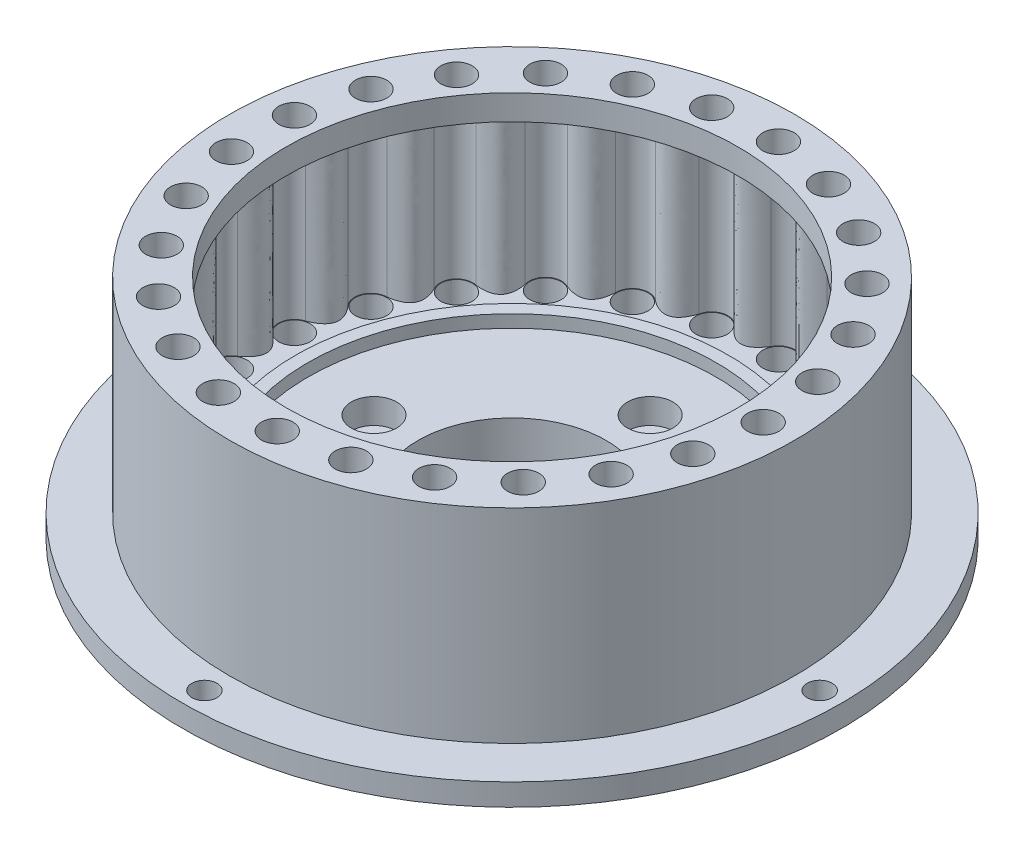
from build123d import *

# Parameters (mm, degrees)
SKETCH1_R           = 45
SKETCH1_R_2         = 2
BOSS_EXTRUDE1_DEPTH = 6
SKETCH2_R           = 3.61
CUT_EXTRUDE1_DEPTH  = 4
SKETCH4_R           = 15
CUT_EXTRUDE2_DEPTH  = 64.921827258
SKETCH5_R           = 2.5
CUT_EXTRUDE3_DEPTH  = 4
SKETCH6_R           = 34.5
SKETCH6_R_2         = 32.5
BOSS_EXTRUDE2_DEPTH = 2
SKETCH7_R           = 45
BOSS_EXTRUDE4_DEPTH = 30
BOSS_EXTRUDE5_START = -4
SKETCH8_R           = 45
SKETCH8_R_2         = 36
BOSS_EXTRUDE5_DEPTH = 4
SKETCH9_R           = 2.5
CUT_EXTRUDE4_DEPTH  = 4
SKETCH11_R          = 52.5
SKETCH11_R_2        = 45
BOSS_EXTRUDE7_DEPTH = 3.5
SKETCH12_R          = 2
CUT_EXTRUDE5_DEPTH  = 5


with BuildPart() as part:
    # Sketch1 → Boss-Extrude1 (new body)
    with BuildSketch(Plane(origin=(0, 0, 0), x_dir=(1, 0, 0), z_dir=(0, 1, 0))):
        with Locations(Location((0, 0, 0), (0, 0, 270))):
            Circle(SKETCH1_R)
        with Locations(Location((0, -22, 0), (0, 0, 270))):
            Circle(SKETCH1_R_2, mode=Mode.SUBTRACT)
        with Locations(Location((-22, 0, 0), (0, 0, 270))):
            Circle(SKETCH1_R_2, mode=Mode.SUBTRACT)
        with Locations(Location((0, 22, 0), (0, 0, 270))):
            Circle(SKETCH1_R_2, mode=Mode.SUBTRACT)
        with Locations(Location((22, 0, 0), (0, 0, 270))):
            Circle(SKETCH1_R_2, mode=Mode.SUBTRACT)
    extrude(amount=BOSS_EXTRUDE1_DEPTH)

    # Sketch2 → Cut-Extrude1 (cut)
    with BuildSketch(Plane(origin=(0, 6, 0), x_dir=(1, 0, 0), z_dir=(0, 1, 0))):
        with Locations(Location((0, 22, 0), (0, 0, 270))):
            Circle(SKETCH2_R)
        with Locations(Location((22, 0, 0), (0, 0, 270))):
            Circle(SKETCH2_R)
        with Locations(Location((0, -22, 0), (0, 0, 270))):
            Circle(SKETCH2_R)
        with Locations(Location((-22, 0, 0), (0, 0, 270))):
            Circle(SKETCH2_R)
    extrude(amount=-CUT_EXTRUDE1_DEPTH, mode=Mode.SUBTRACT)

    # Sketch4 → Cut-Extrude2 (cut, through all)
    with BuildSketch(Plane(origin=(0, 6, 0), x_dir=(1, 0, 0), z_dir=(0, 1, 0))):
        with Locations(Location((0, 0, 0), (0, 0, 270))):
            Circle(SKETCH4_R)
    extrude(amount=-CUT_EXTRUDE2_DEPTH, mode=Mode.SUBTRACT)

    # Sketch5 → Cut-Extrude3 (cut)
    with BuildSketch(Plane(origin=(0, 6, 0), x_dir=(1, 0, 0), z_dir=(0, 1, 0))):
        with Locations(Location((40, 0, 0), (0, 0, 270))):
            Circle(SKETCH5_R)
        with Locations(Location((38.743326445, -9.947595487, 0), (0, 0, 270))):
            Circle(SKETCH5_R)
        with Locations(Location((35.052267202, -19.270146964, 0), (0, 0, 270))):
            Circle(SKETCH5_R)
        with Locations(Location((29.158745097, -27.381884237, 0), (0, 0, 270))):
            Circle(SKETCH5_R)
        with Locations(Location((21.433071799, -33.77311702, 0), (0, 0, 270))):
            Circle(SKETCH5_R)
        with Locations(Location((12.360679775, -38.042260652, 0), (0, 0, 270))):
            Circle(SKETCH5_R)
        with Locations(Location((2.511620781, -39.921069137, 0), (0, 0, 270))):
            Circle(SKETCH5_R)
        with Locations(Location((-7.495252583, -39.291490029, 0), (0, 0, 270))):
            Circle(SKETCH5_R)
        with Locations(Location((-17.031171663, -36.193082099, 0), (0, 0, 270))):
            Circle(SKETCH5_R)
        with Locations(Location((-25.49695959, -30.820529711, 0), (0, 0, 270))):
            Circle(SKETCH5_R)
        with Locations(Location((-32.360679775, -23.511410092, 0), (0, 0, 270))):
            Circle(SKETCH5_R)
        with Locations(Location((-37.191059436, -14.724982107, 0), (0, 0, 270))):
            Circle(SKETCH5_R)
        with Locations(Location((-39.684588053, -5.013329343, 0), (0, 0, 270))):
            Circle(SKETCH5_R)
        with Locations(Location((-39.684588053, 5.013329343, 0), (0, 0, 270))):
            Circle(SKETCH5_R)
        with Locations(Location((-37.191059436, 14.724982107, 0), (0, 0, 270))):
            Circle(SKETCH5_R)
        with Locations(Location((-32.360679775, 23.511410092, 0), (0, 0, 270))):
            Circle(SKETCH5_R)
        with Locations(Location((-25.49695959, 30.820529711, 0), (0, 0, 270))):
            Circle(SKETCH5_R)
        with Locations(Location((-17.031171663, 36.193082099, 0), (0, 0, 270))):
            Circle(SKETCH5_R)
        with Locations(Location((-7.495252583, 39.291490029, 0), (0, 0, 270))):
            Circle(SKETCH5_R)
        with Locations(Location((2.511620781, 39.921069137, 0), (0, 0, 270))):
            Circle(SKETCH5_R)
        with Locations(Location((12.360679775, 38.042260652, 0), (0, 0, 270))):
            Circle(SKETCH5_R)
        with Locations(Location((21.433071799, 33.77311702, 0), (0, 0, 270))):
            Circle(SKETCH5_R)
        with Locations(Location((29.158745097, 27.381884237, 0), (0, 0, 270))):
            Circle(SKETCH5_R)
        with Locations(Location((35.052267202, 19.270146964, 0), (0, 0, 270))):
            Circle(SKETCH5_R)
        with Locations(Location((38.743326445, 9.947595487, 0), (0, 0, 270))):
            Circle(SKETCH5_R)
    extrude(amount=-CUT_EXTRUDE3_DEPTH, mode=Mode.SUBTRACT)

    # Sketch6 → Boss-Extrude2 (add)
    with BuildSketch(Plane(origin=(0, 6, 0), x_dir=(1, 0, 0), z_dir=(0, 1, 0))):
        with Locations(Location((0, 0, 0), (0, 0, 270))):
            Circle(SKETCH6_R)
        with Locations(Location((0, 0, 0), (0, 0, 270))):
            Circle(SKETCH6_R_2, mode=Mode.SUBTRACT)
    extrude(amount=BOSS_EXTRUDE2_DEPTH)

    # Sketch7 → Boss-Extrude4 (add)
    with BuildSketch(Plane(origin=(0, 6, 0), x_dir=(1, 0, 0), z_dir=(0, 1, 0))):
        with Locations(Location((0, 0, 0), (0, 0, 270))):
            Circle(SKETCH7_R)
        with BuildLine():
            ThreePointArc((34.786085666, -21.856485571), (37.33066457, -20.522706517), (37.093357913, -17.659572934))
            add(Edge.make_bspline(
                [(37.093357913, -17.659572934), (36.992833187, -17.498762481), (36.795597124, -17.160956609), (36.491730857, -16.541708189), (36.246669275, -15.818483644), (36.175890696, -15.051815417), (36.318726706, -14.379601147), (36.674766069, -13.791800055), (37.251181949, -13.281374242), (37.924905423, -12.921922435), (38.570319112, -12.678520537), (38.945342047, -12.567288031), (39.128703748, -12.518876166)],
                knots=[0.000576873, 0.000576873, 0.000576873, 0.000576873, 0.063004764, 0.125432655, 0.250288437, 0.375144218, 0.5, 0.624855782, 0.749711563, 0.874567345, 0.936995236, 0.999423127, 0.999423127, 0.999423127, 0.999423127], degree=3))
            ThreePointArc((39.128703748, -12.518876166), (41.261642664, -10.594189193), (40.319759065, -7.880021982))
            add(Edge.make_bspline(
                [(40.319759065, -7.880021982), (40.182400575, -7.749263168), (39.907352141, -7.471120704), (39.459031572, -6.946895579), (39.041810419, -6.3073368), (38.782592844, -5.582356783), (38.753768508, -4.895739488), (38.952442052, -4.237861859), (39.383811029, -3.600123211), (39.946976213, -3.084416029), (40.511581453, -2.688153193), (40.847159953, -2.487150849), (41.012721469, -2.394659731)],
                knots=[0.000576873, 0.000576873, 0.000576873, 0.000576873, 0.063004764, 0.125432655, 0.250288437, 0.375144218, 0.5, 0.624855782, 0.749711563, 0.874567345, 0.936995236, 0.999423127, 0.999423127, 0.999423127, 0.999423127], degree=3))
            ThreePointArc((41.012721469, -2.394659731), (42.6, 0), (41.012721469, 2.394659731))
            add(Edge.make_bspline(
                [(41.012721469, 2.394659731), (40.847159953, 2.487150849), (40.511581453, 2.688153193), (39.946976213, 3.084416029), (39.383811029, 3.600123211), (38.952442052, 4.237861859), (38.753768508, 4.895739488), (38.782592844, 5.582356783), (39.041810419, 6.3073368), (39.459031572, 6.946895579), (39.907352141, 7.471120704), (40.182400575, 7.749263168), (40.319759065, 7.880021982)],
                knots=[0.000576873, 0.000576873, 0.000576873, 0.000576873, 0.063004764, 0.125432655, 0.250288437, 0.375144218, 0.5, 0.624855782, 0.749711563, 0.874567345, 0.936995236, 0.999423127, 0.999423127, 0.999423127, 0.999423127], degree=3))
            ThreePointArc((40.319759065, 7.880021982), (41.261642664, 10.594189193), (39.128703748, 12.518876166))
            add(Edge.make_bspline(
                [(39.128703748, 12.518876166), (38.945342047, 12.567288031), (38.570319112, 12.678520537), (37.924905423, 12.921922435), (37.251181949, 13.281374242), (36.674766069, 13.791800055), (36.318726706, 14.379601147), (36.175890696, 15.051815417), (36.246669275, 15.818483644), (36.491730857, 16.541708189), (36.795597124, 17.160956609), (36.992833187, 17.498762481), (37.093357913, 17.659572934)],
                knots=[0.000576873, 0.000576873, 0.000576873, 0.000576873, 0.063004764, 0.125432655, 0.250288437, 0.375144218, 0.5, 0.624855782, 0.749711563, 0.874567345, 0.936995236, 0.999423127, 0.999423127, 0.999423127, 0.999423127], degree=3))
            ThreePointArc((37.093357913, 17.659572934), (37.33066457, 20.522706517), (34.786085666, 21.856485571))
            add(Edge.make_bspline(
                [(34.786085666, 21.856485571), (34.596445068, 21.857776287), (34.20554177, 21.872249808), (33.519873348, 21.94749693), (32.777924106, 22.128107683), (32.092679653, 22.479148731), (31.601645735, 22.959939581), (31.296124289, 23.575513133), (31.174016594, 24.335696984), (31.231520486, 25.097144438), (31.371839415, 25.772506497), (31.478870041, 26.148750191), (31.536244664, 26.32950797)],
                knots=[0.000576873, 0.000576873, 0.000576873, 0.000576873, 0.063004764, 0.125432655, 0.250288437, 0.375144218, 0.5, 0.624855782, 0.749711563, 0.874567345, 0.936995236, 0.999423127, 0.999423127, 0.999423127, 0.999423127], degree=3))
            ThreePointArc((31.536244664, 26.32950797), (31.054063528, 29.161706713), (28.257729887, 29.820771605))
            add(Edge.make_bspline(
                [(28.257729887, 29.820771605), (28.07372621, 29.774860072), (27.691504438, 29.691665184), (27.008664353, 29.594029476), (26.245108743, 29.584450736), (25.494092146, 29.754049819), (24.898917139, 30.097620571), (24.449907294, 30.617874654), (24.1425858, 31.323808983), (24.00891882, 32.0756348), (23.976873658, 32.764675018), (23.986973718, 33.155715758), (23.997593181, 33.345063188)],
                knots=[0.000576873, 0.000576873, 0.000576873, 0.000576873, 0.063004764, 0.125432655, 0.250288437, 0.375144218, 0.5, 0.624855782, 0.749711563, 0.874567345, 0.936995236, 0.999423127, 0.999423127, 0.999423127, 0.999423127], degree=3))
            ThreePointArc((23.997593181, 33.345063188), (22.826221466, 35.968369626), (19.953837015, 35.911308886))
            add(Edge.make_bspline(
                [(19.953837015, 35.911308886), (19.787031885, 35.821079894), (19.437508041, 35.645444037), (18.800401646, 35.381060311), (18.063216675, 35.181893946), (17.293617069, 35.159394529), (16.631698007, 35.344157369), (16.067412703, 35.736402505), (15.594187551, 36.343730862), (15.277748487, 37.038695063), (15.075352749, 37.698118507), (14.987887619, 38.079385766), (14.951084661, 38.265425451)],
                knots=[0.000576873, 0.000576873, 0.000576873, 0.000576873, 0.063004764, 0.125432655, 0.250288437, 0.375144218, 0.5, 0.624855782, 0.749711563, 0.874567345, 0.936995236, 0.999423127, 0.999423127, 0.999423127, 0.999423127], degree=3))
            ThreePointArc((14.951084661, 38.265425451), (13.16412396, 40.515007594), (10.396171178, 39.745406556))
            add(Edge.make_bspline(
                [(10.396171178, 39.745406556), (10.257045576, 39.616529525), (9.962181528, 39.359488547), (9.41084056, 38.944969004), (8.746346272, 38.56872937), (8.00652043, 38.355545174), (7.319448123, 38.369890772), (6.675343481, 38.609480758), (6.065949146, 39.080042468), (5.586621029, 39.674477895), (5.226591983, 40.262850566), (5.047057419, 40.61038792), (4.965144505, 40.781430303)],
                knots=[0.000576873, 0.000576873, 0.000576873, 0.000576873, 0.063004764, 0.125432655, 0.250288437, 0.375144218, 0.5, 0.624855782, 0.749711563, 0.874567345, 0.936995236, 0.999423127, 0.999423127, 0.999423127, 0.999423127], degree=3))
            ThreePointArc((4.965144505, 40.781430303), (2.674876132, 42.515938631), (0.185275671, 41.08215416))
            add(Edge.make_bspline(
                [(0.185275671, 41.08215416), (0.08257137, 40.922726908), (-0.13910549, 40.600431637), (-0.570038249, 40.061822065), (-1.120089235, 39.532149681), (-1.783655334, 39.141675854), (-2.452709606, 38.984702824), (-3.136162123, 39.056583339), (-3.843435152, 39.360811279), (-4.455534375, 39.817367369), (-4.95057478, 40.297719647), (-5.21089796, 40.589690046), (-5.33277394, 40.734987905)],
                knots=[0.000576873, 0.000576873, 0.000576873, 0.000576873, 0.063004764, 0.125432655, 0.250288437, 0.375144218, 0.5, 0.624855782, 0.749711563, 0.874567345, 0.936995236, 0.999423127, 0.999423127, 0.999423127, 0.999423127], degree=3))
            ThreePointArc((-5.33277394, 40.734987905), (-7.982444001, 41.845436881), (-10.037261387, 39.837558928))
            add(Edge.make_bspline(
                [(-10.037261387, 39.837558928), (-10.097091098, 39.657598855), (-10.231651998, 39.290300289), (-10.515099458, 38.661443509), (-10.916145416, 38.011619639), (-11.461757473, 37.468391087), (-12.07075457, 37.149962622), (-12.750611127, 37.049617149), (-13.511322285, 37.168395559), (-14.217732168, 37.458385213), (-14.816678722, 37.800534799), (-15.141433456, 38.018592668), (-15.295614586, 38.129016404)],
                knots=[0.000576873, 0.000576873, 0.000576873, 0.000576873, 0.063004764, 0.125432655, 0.250288437, 0.375144218, 0.5, 0.624855782, 0.749711563, 0.874567345, 0.936995236, 0.999423127, 0.999423127, 0.999423127, 0.999423127], degree=3))
            ThreePointArc((-15.295614586, 38.129016404), (-18.138197821, 38.545632435), (-19.629120398, 36.089823356))
            add(Edge.make_bspline(
                [(-19.629120398, 36.089823356), (-19.642316199, 35.900638016), (-19.681306181, 35.511414875), (-19.799458296, 34.83182427), (-20.026300033, 34.102679738), (-20.419675237, 33.440829508), (-20.930349631, 32.98095364), (-21.56389234, 32.714687254), (-22.330243348, 32.64055285), (-23.086577559, 32.745754952), (-23.751796248, 32.928203329), (-24.120577002, 33.058647291), (-24.297375514, 33.127258574)],
                knots=[0.000576873, 0.000576873, 0.000576873, 0.000576873, 0.063004764, 0.125432655, 0.250288437, 0.375144218, 0.5, 0.624855782, 0.749711563, 0.874567345, 0.936995236, 0.999423127, 0.999423127, 0.999423127, 0.999423127], degree=3))
            ThreePointArc((-24.297375514, 33.127258574), (-27.154261963, 32.823864142), (-27.987609584, 30.074431454))
            add(Edge.make_bspline(
                [(-27.987609584, 30.074431454), (-27.953342333, 29.887908057), (-27.894311514, 29.501216663), (-27.839744353, 28.813593409), (-27.878128568, 28.050943048), (-28.094549707, 27.312057625), (-28.474813849, 26.739630046), (-29.022234891, 26.324173243), (-29.746073096, 26.061784162), (-30.504808376, 25.975588477), (-31.194501062, 25.986871742), (-31.584135985, 26.021505523), (-31.77244298, 26.043993254)],
                knots=[0.000576873, 0.000576873, 0.000576873, 0.000576873, 0.063004764, 0.125432655, 0.250288437, 0.375144218, 0.5, 0.624855782, 0.749711563, 0.874567345, 0.936995236, 0.999423127, 0.999423127, 0.999423127, 0.999423127], degree=3))
            ThreePointArc((-31.77244298, 26.043993254), (-34.46412396, 25.039651748), (-34.587534328, 22.169352418))
            add(Edge.make_bspline(
                [(-34.587534328, 22.169352418), (-34.507957163, 21.997210914), (-34.354614667, 21.637348509), (-34.130756884, 20.984898506), (-33.978271756, 20.236662442), (-34.004140295, 19.467168715), (-34.230100789, 18.818157154), (-34.657003687, 18.279614614), (-35.292847673, 17.845457726), (-36.006309894, 17.573280246), (-36.67714065, 17.41268943), (-37.063147546, 17.349336862), (-37.251131002, 17.324288055)],
                knots=[0.000576873, 0.000576873, 0.000576873, 0.000576873, 0.063004764, 0.125432655, 0.250288437, 0.375144218, 0.5, 0.624855782, 0.749711563, 0.874567345, 0.936995236, 0.999423127, 0.999423127, 0.999423127, 0.999423127], degree=3))
            ThreePointArc((-37.251131002, 17.324288055), (-39.608478299, 15.682105944), (-39.014197086, 12.871291436))
            add(Edge.make_bspline(
                [(-39.014197086, 12.871291436), (-38.894310133, 12.72434811), (-38.656291033, 12.413926172), (-38.277208436, 11.837645253), (-37.943435166, 11.15083791), (-37.77712569, 10.399085999), (-37.834584607, 9.71427024), (-38.114145482, 9.086480571), (-38.622042832, 8.507835551), (-39.245402539, 8.066778187), (-39.855220601, 7.744403802), (-40.213345238, 7.58704556), (-40.389193463, 7.516034123)],
                knots=[0.000576873, 0.000576873, 0.000576873, 0.000576873, 0.063004764, 0.125432655, 0.250288437, 0.375144218, 0.5, 0.624855782, 0.749711563, 0.874567345, 0.936995236, 0.999423127, 0.999423127, 0.999423127, 0.999423127], degree=3))
            ThreePointArc((-40.389193463, 7.516034123), (-42.264086276, 5.33919575), (-40.989454357, 2.764479875))
            add(Edge.make_bspline(
                [(-40.989454357, 2.764479875), (-40.836790555, 2.651967717), (-40.529050465, 2.410491199), (-40.018562208, 1.946589212), (-39.524472999, 1.364365222), (-39.176435343, 0.677590465), (-39.061782329, 0), (-39.176435343, -0.677590465), (-39.524472999, -1.364365222), (-40.018562208, -1.946589212), (-40.529050465, -2.410491199), (-40.836790555, -2.651967717), (-40.989454357, -2.764479875)],
                knots=[0.000576873, 0.000576873, 0.000576873, 0.000576873, 0.063004764, 0.125432655, 0.250288437, 0.375144218, 0.5, 0.624855782, 0.749711563, 0.874567345, 0.936995236, 0.999423127, 0.999423127, 0.999423127, 0.999423127], degree=3))
            ThreePointArc((-40.989454357, -2.764479875), (-42.264086276, -5.33919575), (-40.389193463, -7.516034123))
            add(Edge.make_bspline(
                [(-40.389193463, -7.516034123), (-40.213345238, -7.58704556), (-39.855220601, -7.744403802), (-39.245402539, -8.066778187), (-38.622042832, -8.507835551), (-38.114145482, -9.086480571), (-37.834584607, -9.71427024), (-37.77712569, -10.399085999), (-37.943435166, -11.15083791), (-38.277208436, -11.837645253), (-38.656291033, -12.413926172), (-38.894310133, -12.72434811), (-39.014197086, -12.871291436)],
                knots=[0.000576873, 0.000576873, 0.000576873, 0.000576873, 0.063004764, 0.125432655, 0.250288437, 0.375144218, 0.5, 0.624855782, 0.749711563, 0.874567345, 0.936995236, 0.999423127, 0.999423127, 0.999423127, 0.999423127], degree=3))
            ThreePointArc((-39.014197086, -12.871291436), (-39.608478299, -15.682105944), (-37.251131002, -17.324288055))
            add(Edge.make_bspline(
                [(-37.251131002, -17.324288055), (-37.063147546, -17.349336862), (-36.67714065, -17.41268943), (-36.006309894, -17.573280246), (-35.292847673, -17.845457726), (-34.657003687, -18.279614614), (-34.230100789, -18.818157154), (-34.004140295, -19.467168715), (-33.978271756, -20.236662442), (-34.130756884, -20.984898506), (-34.354614667, -21.637348509), (-34.507957163, -21.997210914), (-34.587534328, -22.169352418)],
                knots=[0.000576873, 0.000576873, 0.000576873, 0.000576873, 0.063004764, 0.125432655, 0.250288437, 0.375144218, 0.5, 0.624855782, 0.749711563, 0.874567345, 0.936995236, 0.999423127, 0.999423127, 0.999423127, 0.999423127], degree=3))
            ThreePointArc((-34.587534328, -22.169352418), (-34.46412396, -25.039651748), (-31.77244298, -26.043993254))
            add(Edge.make_bspline(
                [(-31.77244298, -26.043993254), (-31.584135985, -26.021505523), (-31.194501062, -25.986871742), (-30.504808376, -25.975588477), (-29.746073096, -26.061784162), (-29.022234891, -26.324173243), (-28.474813849, -26.739630046), (-28.094549707, -27.312057625), (-27.878128568, -28.050943048), (-27.839744353, -28.813593409), (-27.894311514, -29.501216663), (-27.953342333, -29.887908057), (-27.987609584, -30.074431454)],
                knots=[0.000576873, 0.000576873, 0.000576873, 0.000576873, 0.063004764, 0.125432655, 0.250288437, 0.375144218, 0.5, 0.624855782, 0.749711563, 0.874567345, 0.936995236, 0.999423127, 0.999423127, 0.999423127, 0.999423127], degree=3))
            ThreePointArc((-27.987609584, -30.074431454), (-27.154261963, -32.823864142), (-24.297375514, -33.127258574))
            add(Edge.make_bspline(
                [(-24.297375514, -33.127258574), (-24.120577002, -33.058647291), (-23.751796248, -32.928203329), (-23.086577559, -32.745754952), (-22.330243348, -32.64055285), (-21.56389234, -32.714687254), (-20.930349631, -32.98095364), (-20.419675237, -33.440829508), (-20.026300033, -34.102679738), (-19.799458296, -34.83182427), (-19.681306181, -35.511414875), (-19.642316199, -35.900638016), (-19.629120398, -36.089823356)],
                knots=[0.000576873, 0.000576873, 0.000576873, 0.000576873, 0.063004764, 0.125432655, 0.250288437, 0.375144218, 0.5, 0.624855782, 0.749711563, 0.874567345, 0.936995236, 0.999423127, 0.999423127, 0.999423127, 0.999423127], degree=3))
            ThreePointArc((-19.629120398, -36.089823356), (-18.138197821, -38.545632435), (-15.295614586, -38.129016404))
            add(Edge.make_bspline(
                [(-15.295614586, -38.129016404), (-15.141433456, -38.018592668), (-14.816678722, -37.800534799), (-14.217732168, -37.458385213), (-13.511322285, -37.168395559), (-12.750611127, -37.049617149), (-12.07075457, -37.149962622), (-11.461757473, -37.468391087), (-10.916145416, -38.011619639), (-10.515099458, -38.661443509), (-10.231651998, -39.290300289), (-10.097091098, -39.657598855), (-10.037261387, -39.837558928)],
                knots=[0.000576873, 0.000576873, 0.000576873, 0.000576873, 0.063004764, 0.125432655, 0.250288437, 0.375144218, 0.5, 0.624855782, 0.749711563, 0.874567345, 0.936995236, 0.999423127, 0.999423127, 0.999423127, 0.999423127], degree=3))
            ThreePointArc((-10.037261387, -39.837558928), (-7.982444001, -41.845436881), (-5.33277394, -40.734987905))
            add(Edge.make_bspline(
                [(-5.33277394, -40.734987905), (-5.21089796, -40.589690046), (-4.95057478, -40.297719647), (-4.455534375, -39.817367369), (-3.843435152, -39.360811279), (-3.136162123, -39.056583339), (-2.452709606, -38.984702824), (-1.783655334, -39.141675854), (-1.120089235, -39.532149681), (-0.570038249, -40.061822065), (-0.13910549, -40.600431637), (0.08257137, -40.922726908), (0.185275671, -41.08215416)],
                knots=[0.000576873, 0.000576873, 0.000576873, 0.000576873, 0.063004764, 0.125432655, 0.250288437, 0.375144218, 0.5, 0.624855782, 0.749711563, 0.874567345, 0.936995236, 0.999423127, 0.999423127, 0.999423127, 0.999423127], degree=3))
            ThreePointArc((0.185275671, -41.08215416), (2.674876132, -42.515938631), (4.965144505, -40.781430303))
            add(Edge.make_bspline(
                [(4.965144505, -40.781430303), (5.047057419, -40.61038792), (5.226591983, -40.262850566), (5.586621029, -39.674477895), (6.065949146, -39.080042468), (6.675343481, -38.609480758), (7.319448123, -38.369890772), (8.00652043, -38.355545174), (8.746346272, -38.56872937), (9.41084056, -38.944969004), (9.962181528, -39.359488547), (10.257045576, -39.616529525), (10.396171178, -39.745406556)],
                knots=[0.000576873, 0.000576873, 0.000576873, 0.000576873, 0.063004764, 0.125432655, 0.250288437, 0.375144218, 0.5, 0.624855782, 0.749711563, 0.874567345, 0.936995236, 0.999423127, 0.999423127, 0.999423127, 0.999423127], degree=3))
            ThreePointArc((10.396171178, -39.745406556), (13.16412396, -40.515007594), (14.951084661, -38.265425451))
            add(Edge.make_bspline(
                [(14.951084661, -38.265425451), (14.987887619, -38.079385766), (15.075352749, -37.698118507), (15.277748487, -37.038695063), (15.594187551, -36.343730862), (16.067412703, -35.736402505), (16.631698007, -35.344157369), (17.293617069, -35.159394529), (18.063216675, -35.181893946), (18.800401646, -35.381060311), (19.437508041, -35.645444037), (19.787031885, -35.821079894), (19.953837015, -35.911308886)],
                knots=[0.000576873, 0.000576873, 0.000576873, 0.000576873, 0.063004764, 0.125432655, 0.250288437, 0.375144218, 0.5, 0.624855782, 0.749711563, 0.874567345, 0.936995236, 0.999423127, 0.999423127, 0.999423127, 0.999423127], degree=3))
            ThreePointArc((19.953837015, -35.911308886), (22.826221466, -35.968369626), (23.997593181, -33.345063188))
            add(Edge.make_bspline(
                [(23.997593181, -33.345063188), (23.986973718, -33.155715758), (23.976873658, -32.764675018), (24.00891882, -32.0756348), (24.1425858, -31.323808983), (24.449907294, -30.617874654), (24.898917139, -30.097620571), (25.494092146, -29.754049819), (26.245108743, -29.584450736), (27.008664353, -29.594029476), (27.691504438, -29.691665184), (28.07372621, -29.774860072), (28.257729887, -29.820771605)],
                knots=[0.000576873, 0.000576873, 0.000576873, 0.000576873, 0.063004764, 0.125432655, 0.250288437, 0.375144218, 0.5, 0.624855782, 0.749711563, 0.874567345, 0.936995236, 0.999423127, 0.999423127, 0.999423127, 0.999423127], degree=3))
            ThreePointArc((28.257729887, -29.820771605), (31.054063528, -29.161706713), (31.536244664, -26.32950797))
            add(Edge.make_bspline(
                [(31.536244664, -26.32950797), (31.478870041, -26.148750191), (31.371839415, -25.772506497), (31.231520486, -25.097144438), (31.174016594, -24.335696984), (31.296124289, -23.575513133), (31.601645735, -22.959939581), (32.092679653, -22.479148731), (32.777924106, -22.128107683), (33.519873348, -21.94749693), (34.20554177, -21.872249808), (34.596445068, -21.857776287), (34.786085666, -21.856485571)],
                knots=[0.000576873, 0.000576873, 0.000576873, 0.000576873, 0.063004764, 0.125432655, 0.250288437, 0.375144218, 0.5, 0.624855782, 0.749711563, 0.874567345, 0.936995236, 0.999423127, 0.999423127, 0.999423127, 0.999423127], degree=3))
        make_face(mode=Mode.SUBTRACT)
    extrude(amount=BOSS_EXTRUDE4_DEPTH)

    # Sketch8 → Boss-Extrude5 (add)
    with BuildSketch(Plane(origin=(0, 36, 0), x_dir=(1, 0, 0), z_dir=(0, 1, 0)).offset(BOSS_EXTRUDE5_START)):
        with Locations(Location((0, 0, 0), (0, 0, 270))):
            Circle(SKETCH8_R)
        with Locations(Location((0, 0, 0), (0, 0, 270))):
            Circle(SKETCH8_R_2, mode=Mode.SUBTRACT)
    extrude(amount=BOSS_EXTRUDE5_DEPTH)

    # Sketch9 → Cut-Extrude4 (cut)
    with BuildSketch(Plane(origin=(0, 36, 0), x_dir=(1, 0, 0), z_dir=(0, 1, 0))):
        with Locations(Location((-17.031171663, 36.193082099, 0), (0, 0, 270))):
            Circle(SKETCH9_R)
        with Locations(Location((-7.495252583, 39.291490029, 0), (0, 0, 270))):
            Circle(SKETCH9_R)
        with Locations(Location((12.360679775, 38.042260652, 0), (0, 0, 270))):
            Circle(SKETCH9_R)
        with Locations(Location((21.433071799, 33.77311702, 0), (0, 0, 270))):
            Circle(SKETCH9_R)
        with Locations(Location((29.158745097, 27.381884237, 0), (0, 0, 270))):
            Circle(SKETCH9_R)
        with Locations(Location((35.052267202, 19.270146964, 0), (0, 0, 270))):
            Circle(SKETCH9_R)
        with Locations(Location((38.743326445, 9.947595487, 0), (0, 0, 270))):
            Circle(SKETCH9_R)
        with Locations(Location((40, 0, 0), (0, 0, 270))):
            Circle(SKETCH9_R)
        with Locations(Location((38.743326445, -9.947595487, 0), (0, 0, 270))):
            Circle(SKETCH9_R)
        with Locations(Location((35.052267202, -19.270146964, 0), (0, 0, 270))):
            Circle(SKETCH9_R)
        with Locations(Location((29.158745097, -27.381884237, 0), (0, 0, 270))):
            Circle(SKETCH9_R)
        with Locations(Location((-7.495252583, -39.291490029, 0), (0, 0, 270))):
            Circle(SKETCH9_R)
        with Locations(Location((12.360679775, -38.042260652, 0), (0, 0, 270))):
            Circle(SKETCH9_R)
        with Locations(Location((2.511620781, 39.921069137, 0), (0, 0, 270))):
            Circle(SKETCH9_R)
        with Locations(Location((-25.49695959, 30.820529711, 0), (0, 0, 270))):
            Circle(SKETCH9_R)
        with Locations(Location((-32.360679775, 23.511410092, 0), (0, 0, 270))):
            Circle(SKETCH9_R)
        with Locations(Location((-37.191059436, 14.724982107, 0), (0, 0, 270))):
            Circle(SKETCH9_R)
        with Locations(Location((-39.684588053, 5.013329343, 0), (0, 0, 270))):
            Circle(SKETCH9_R)
        with Locations(Location((-39.684588053, -5.013329343, 0), (0, 0, 270))):
            Circle(SKETCH9_R)
        with Locations(Location((-37.191059436, -14.724982107, 0), (0, 0, 270))):
            Circle(SKETCH9_R)
        with Locations(Location((-32.360679775, -23.511410092, 0), (0, 0, 270))):
            Circle(SKETCH9_R)
        with Locations(Location((-25.49695959, -30.820529711, 0), (0, 0, 270))):
            Circle(SKETCH9_R)
        with Locations(Location((-17.031171663, -36.193082099, 0), (0, 0, 270))):
            Circle(SKETCH9_R)
        with Locations(Location((2.511620781, -39.921069137, 0), (0, 0, 270))):
            Circle(SKETCH9_R)
        with Locations(Location((21.433071799, -33.77311702, 0), (0, 0, 270))):
            Circle(SKETCH9_R)
    extrude(amount=-CUT_EXTRUDE4_DEPTH, mode=Mode.SUBTRACT)

    # Sketch11 → Boss-Extrude7 (add)
    with BuildSketch(Plane.XZ):
        with Locations(Location((0, 0, 0), (0, 0, 270))):
            Circle(SKETCH11_R)
        with Locations(Location((0, 0, 0), (0, 0, 270))):
            Circle(SKETCH11_R_2, mode=Mode.SUBTRACT)
    extrude(amount=-BOSS_EXTRUDE7_DEPTH)

    # Sketch12 → Cut-Extrude5 (cut)
    with BuildSketch(Plane(origin=(0, 3.5, 0), x_dir=(1, 0, 0), z_dir=(0, 1, 0))):
        with Locations(Location((0, -49, 0), (0, 0, 270))):
            Circle(SKETCH12_R)
        with Locations(Location((-49, 0, 0), (0, 0, 270))):
            Circle(SKETCH12_R)
        with Locations(Location((0, 49, 0), (0, 0, 270))):
            Circle(SKETCH12_R)
        with Locations(Location((49, 0, 0), (0, 0, 270))):
            Circle(SKETCH12_R)
    extrude(amount=-CUT_EXTRUDE5_DEPTH, mode=Mode.SUBTRACT)


solid = part.part
